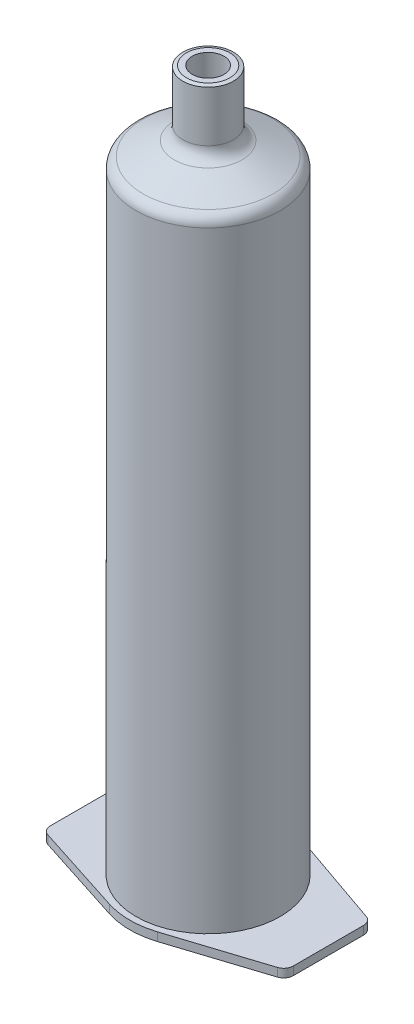
from build123d import *

# Parameters (mm, degrees)
BOSS_EXTRUDE1_DEPTH = 1.75
FILLET1_R           = 1
FILLET2_R           = 1.5
FILLET3_R           = 2
FILLET4_R           = 2.5
FILLET5_R           = 3
FILLET6_R           = 4
FILLET7_R           = 16.3
CUT_EXTRUDE1_REACH  = 152.576
SKETCH4_R           = 17.447294951


with BuildPart() as part:
    # Sketch1 → Boss-Extrude1 (new body)
    with BuildSketch(Plane.XZ.offset(122.00000003)):
        Polygon((0, -17.251221002), (25.25, -8.499999866), (25.25, 9.000000134), (0, 17.122631398), (-25.25, 9.000000134), (-25.25, -8.499999866), align=None)
    extrude(amount=-BOSS_EXTRUDE1_DEPTH)

    # Sketch2 → Revolve1 (revolve)
    with BuildSketch(Plane(origin=(0, 0, 0), x_dir=(-1, 0, 0), z_dir=(0, 0, -1)), mode=Mode.PRIVATE) as revolve1_sk:
        Polygon((-15.000000104, -120.25000003), (0, -120.25000003), (0, 50.000000745), (-3.000000045, 50.000000745), (-4.510515864, 25.545941813), (-5.250000063, 25.308142899), (-5.250000063, 12.808142939), (-15.000000104, 8.474809587), align=None)
    revolve(revolve1_sk.sketch.rotate(Axis((0, -120.25000003, 0), (0, 1, 0)), 270), axis=Axis((0, -120.25000003, 0), (0, 1, 0)))

    # Sketch3 → Cut-Revolve1 (revolve, cut)
    with BuildSketch(Plane(origin=(0, 0, 0), x_dir=(-1, 0, 0), z_dir=(0, 0, -1)), mode=Mode.PRIVATE) as cut_revolve1_sk:
        Polygon((-14.00000011, -122.00000003), (0, -122.00000003), (0, 50.000000745), (-1.700000001, 50.000000745), (-4.165865434, 12.195663018), (-14.00000011, 7.824936496), align=None)
    revolve(cut_revolve1_sk.sketch.rotate(Axis((0, -122.00000003, 0), (0, 1, 0)), 90), axis=Axis((0, -122.00000003, 0), (0, 1, 0)), mode=Mode.SUBTRACT)

    # Fillet1
    fillet1_edges = [part.edges().sort_by_distance(p)[0] for p in [
        (0, 50.000000745, -3.000000045),
    ]]
    fillet(fillet1_edges, radius=FILLET1_R)

    # Fillet2
    fillet2_edges = [part.edges().sort_by_distance(p)[0] for p in [
        (0, 7.824936496, 14.00000011),
    ]]
    fillet(fillet2_edges, radius=FILLET2_R)

    # Fillet3
    fillet3_edges = [part.edges().sort_by_distance(p)[0] for p in [
        (-25.25, -121.12500003, -8.499999866),
        (-25.25, -121.12500003, 9.000000134),
        (25.25, -121.12500003, 9.000000134),
        (25.25, -121.12500003, -8.499999866),
    ]]
    fillet(fillet3_edges, radius=FILLET3_R)

    # Fillet4
    fillet4_edges = [part.edges().sort_by_distance(p)[0] for p in [
        (0, 8.474809587, -15.000000104),
    ]]
    fillet(fillet4_edges, radius=FILLET4_R)

    # Fillet5
    fillet5_edges = [part.edges().sort_by_distance(p)[0] for p in [
        (0, 12.808142939, -5.250000063),
    ]]
    fillet(fillet5_edges, radius=FILLET5_R)

    # Fillet6
    fillet6_edges = [part.edges().sort_by_distance(p)[0] for p in [
        (0, 12.195663018, 4.165865434),
    ]]
    fillet(fillet6_edges, radius=FILLET6_R)

    # Fillet7
    fillet7_edges = [part.edges().sort_by_distance(p)[0] for p in [
        (0, -121.12500003, 17.122631398),
        (0, -121.12500003, -17.251221002),
    ]]
    fillet(fillet7_edges, radius=FILLET7_R)

    # Sketch4 → Cut-Extrude1 (cut, up to next)
    with BuildSketch(Plane(origin=(0, 25.545941813, 0), x_dir=(-1, 0, 0), z_dir=(0, -1, 0)), mode=Mode.PRIVATE) as cut_extrude1_sk1:
        Circle(SKETCH4_R)
    cut_extrude1_tool1 = extrude(cut_extrude1_sk1.sketch, amount=-CUT_EXTRUDE1_REACH, mode=Mode.PRIVATE) & part.part
    add(cut_extrude1_tool1.solids().sort_by_distance((0, 25.545942, 0))[0], mode=Mode.SUBTRACT)


solid = part.part
